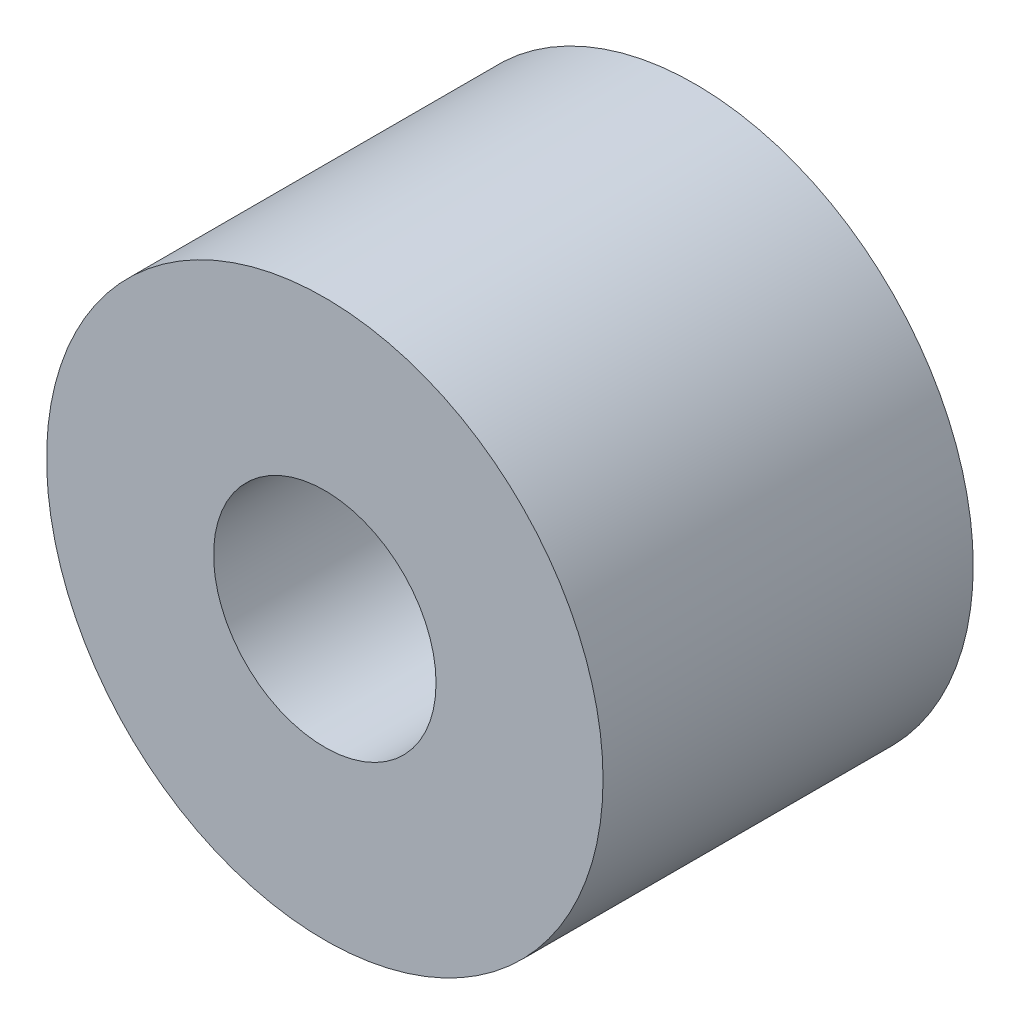
from build123d import *

# Parameters (mm, degrees)
SZKIC2_R                    = 953
SZKIC2_R_2                  = 381
DODANIE_WYCI_GNI_CIE2_DEPTH = 1268


with BuildPart() as part:
    # Szkic2 → Dodanie-wyciągnięcie2 (new body)
    with BuildSketch(Plane.XY):
        Circle(SZKIC2_R)
        Circle(SZKIC2_R_2, mode=Mode.SUBTRACT)
    extrude(amount=DODANIE_WYCI_GNI_CIE2_DEPTH)


solid = part.part
